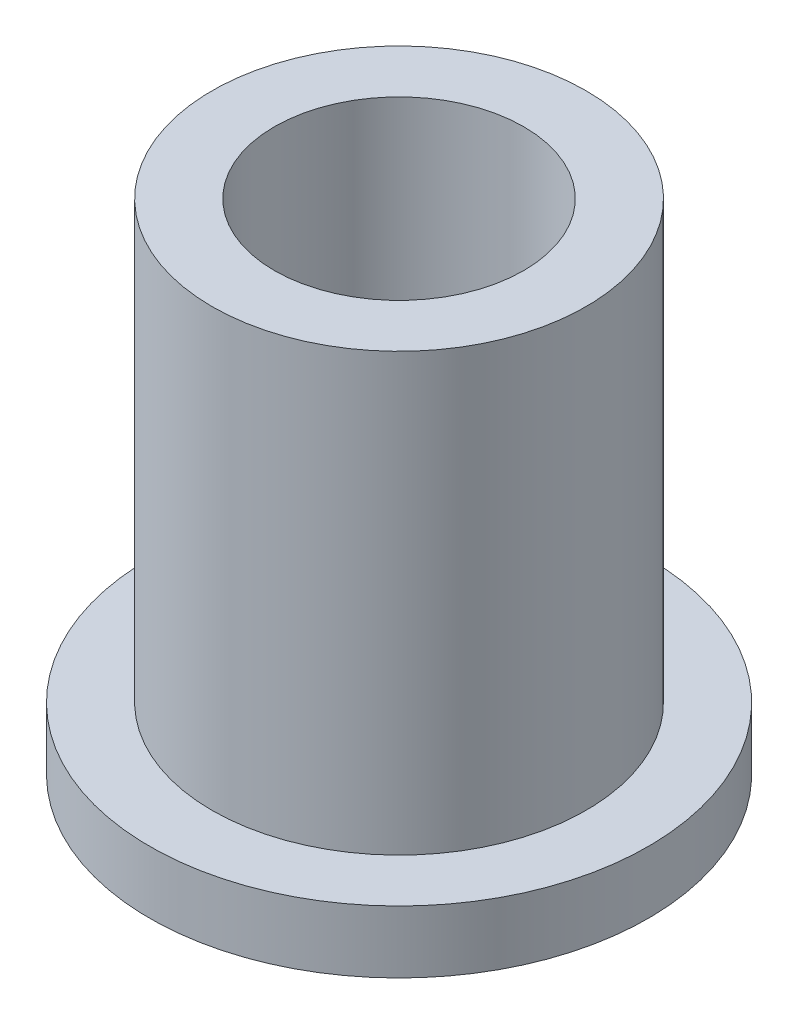
from build123d import *

# Parameters (mm, degrees)
SKETCH1_R           = 4.7625
SKETCH1_R_2         = 3.175
BOSS_EXTRUDE1_DEPTH = 12.7
SKETCH2_R           = 6.35
SKETCH2_R_2         = 4.7625
BOSS_EXTRUDE2_DEPTH = 1.5875


with BuildPart() as part:
    # Sketch1 → Boss-Extrude1 (new body)
    with BuildSketch(Plane(origin=(0, 0, 0), x_dir=(1, 0, 0), z_dir=(0, 1, 0))):
        with Locations(Location((0, 0, 0), (0, 0, 270))):
            Circle(SKETCH1_R)
        with Locations(Location((0, 0, 0), (0, 0, 270))):
            Circle(SKETCH1_R_2, mode=Mode.SUBTRACT)
    extrude(amount=BOSS_EXTRUDE1_DEPTH)

    # Sketch2 → Boss-Extrude2 (add)
    with BuildSketch(Plane.XZ):
        with Locations(Location((0, 0, 0), (0, 0, 270))):
            Circle(SKETCH2_R)
        with Locations(Location((0, 0, 0), (0, 0, 270))):
            Circle(SKETCH2_R_2, mode=Mode.SUBTRACT)
    extrude(amount=-BOSS_EXTRUDE2_DEPTH)


solid = part.part
